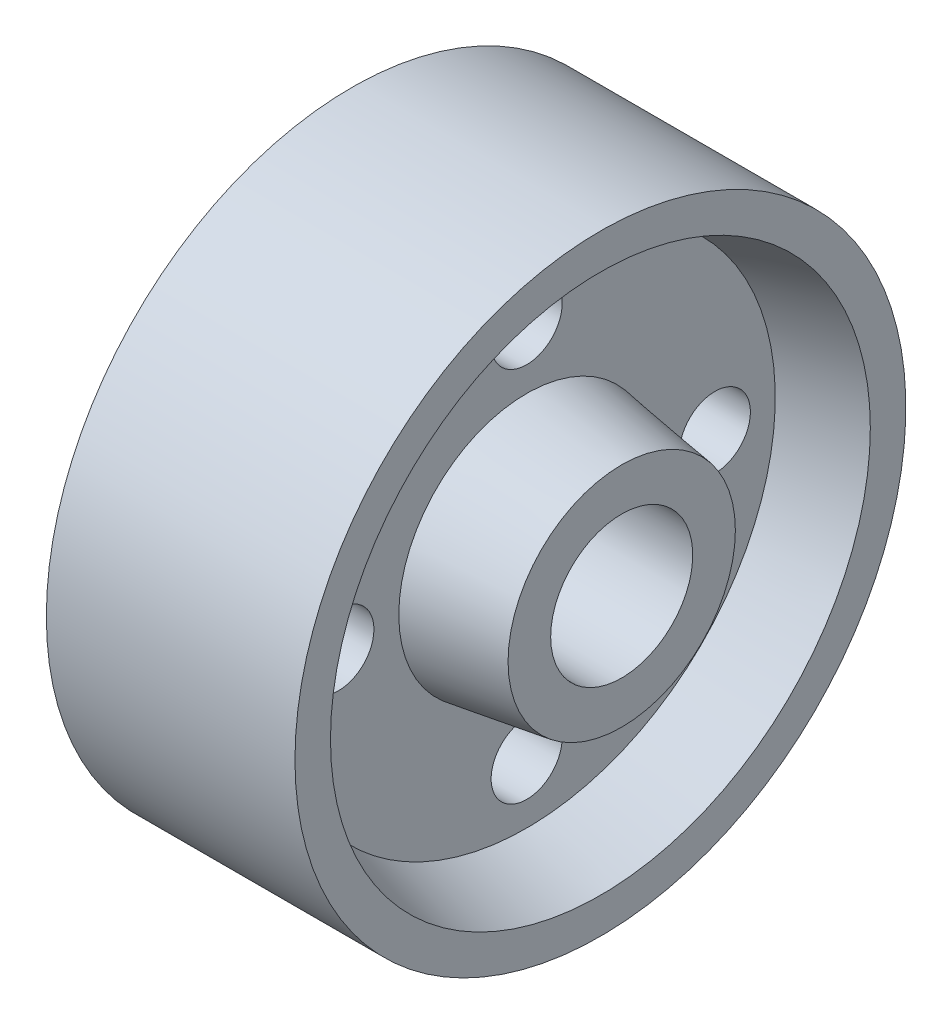
from build123d import *

# Parameters (mm, degrees)
SKETCH2_R          = 5
CUT_EXTRUDE1_DEPTH = 25


with BuildPart() as part:
    # Sketch1 → Revolve1 (revolve)
    with BuildSketch(Plane.XY, mode=Mode.PRIVATE) as revolve1_sk:
        Polygon((67.539059874, 10), (26.539059874, 10), (26.539059874, 16), (39.922105525, 18), (39.922105525, 35), (29.539059874, 38), (29.539059874, 43), (64.539059874, 43), (64.539059874, 38), (54.156014223, 35), (54.156014223, 18), (67.539059874, 16), align=None)
    revolve(revolve1_sk.sketch.rotate(Axis((0, 0, 0), (1, 0, 0)), 90), axis=Axis((0, 0, 0), (1, 0, 0)))

    # Sketch2 → Cut-Extrude1 (cut)
    with BuildSketch(Plane(origin=(54.156014223, 0, 0), x_dir=(0, 0, -1), z_dir=(1, 0, 0))):
        with Locations((0, 26.5)):
            Circle(SKETCH2_R)
        with Locations((26.5, 0)):
            Circle(SKETCH2_R)
        with Locations((0, -26.5)):
            Circle(SKETCH2_R)
        with Locations((-26.5, 0)):
            Circle(SKETCH2_R)
    extrude(amount=-CUT_EXTRUDE1_DEPTH, mode=Mode.SUBTRACT)


solid = part.part
